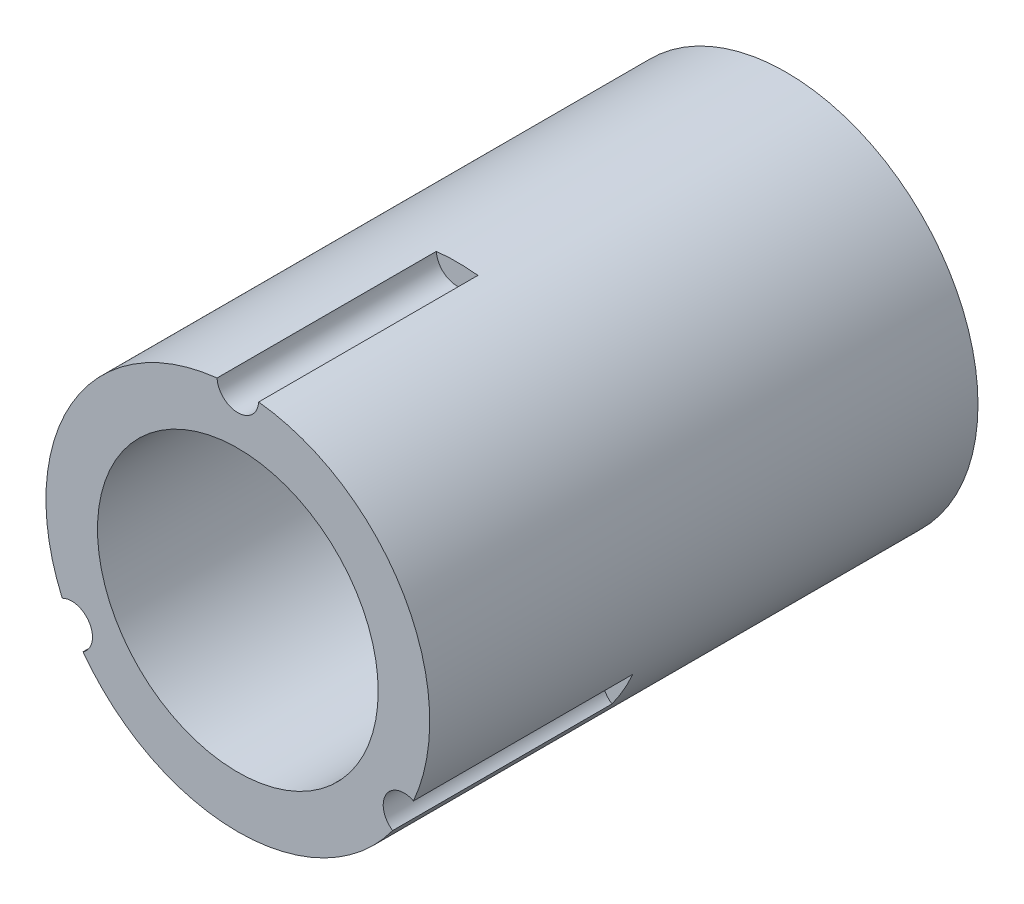
from build123d import *

# Parameters (mm, degrees)
ESQUISSE1_R             = 17.5
BOSS_EXTRU_1_DEPTH      = 50
ESQUISSE4_R             = 12.8
ENL_V_MAT_EXTRU_1_DEPTH = 50
ESQUISSE5_R             = 1.9
ENL_V_MAT_EXTRU_2_DEPTH = 20


with BuildPart() as part:
    # Esquisse1 → Boss.-Extru.1 (new body)
    with BuildSketch(Plane.XY):
        Circle(ESQUISSE1_R)
    extrude(amount=BOSS_EXTRU_1_DEPTH)

    # Esquisse4 → Enlèv. mat.-Extru.1 (cut)
    with BuildSketch(Plane.XY.offset(50)):
        Circle(ESQUISSE4_R)
    extrude(amount=-ENL_V_MAT_EXTRU_1_DEPTH, mode=Mode.SUBTRACT)

    # Esquisse5 → Enlèv. mat.-Extru.2 (cut)
    with BuildSketch(Plane.XY.offset(50)):
        with Locations((0, 17.5)):
            Circle(ESQUISSE5_R)
        with Locations((15.155444566, -8.75)):
            Circle(ESQUISSE5_R)
        with Locations((-15.155444566, -8.75)):
            Circle(ESQUISSE5_R)
    extrude(amount=-ENL_V_MAT_EXTRU_2_DEPTH, mode=Mode.SUBTRACT)


solid = part.part
